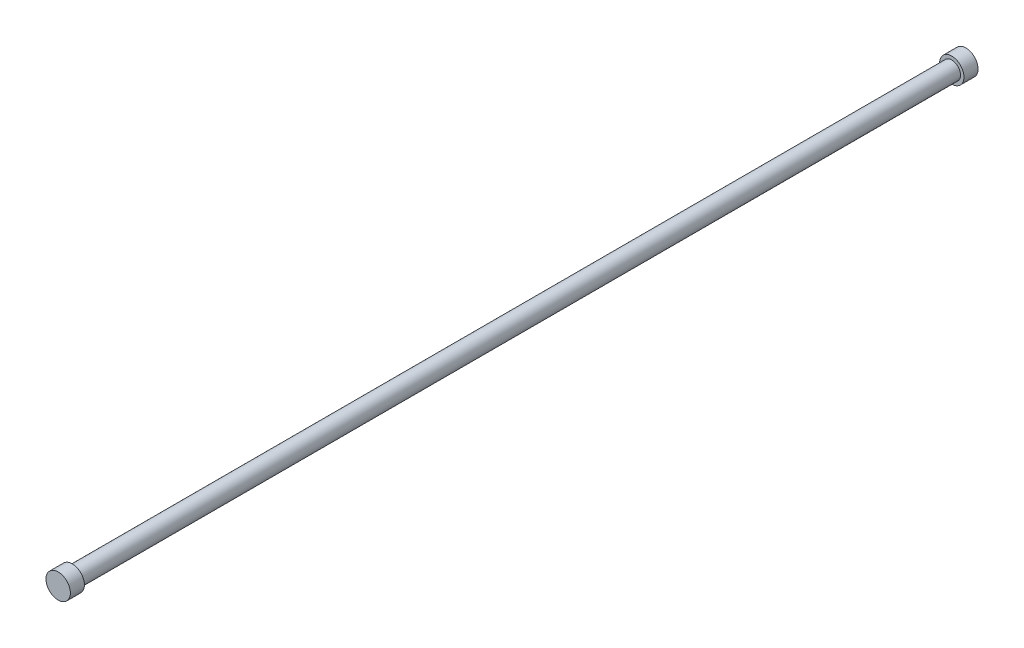
from build123d import *

# Parameters (mm, degrees)
SKETCH1_R           = 3.175
BOSS_EXTRUDE1_DEPTH = 317.5
SKETCH2_R           = 4.401668224
BOSS_EXTRUDE2_DEPTH = 5.08
BOSS_EXTRUDE3_START = 5.08
SKETCH3_R           = 4.401668224
BOSS_EXTRUDE3_DEPTH = 5.08


with BuildPart() as part:
    # Sketch1 → Boss-Extrude1 (new body)
    with BuildSketch(Plane.XY):
        with Locations(Location((0, 0, 0), (0, 0, 180))):
            Circle(SKETCH1_R)
    extrude(amount=BOSS_EXTRUDE1_DEPTH)

    # Sketch2 → Boss-Extrude2 (add)
    with BuildSketch(Plane(origin=(0, 0, 0), x_dir=(-1, 0, 0), z_dir=(0, 0, -1))):
        Circle(SKETCH2_R)
    extrude(amount=BOSS_EXTRUDE2_DEPTH)

    # Sketch3 → Boss-Extrude3 (add)
    with BuildSketch(Plane.XY.offset(317.5).offset(BOSS_EXTRUDE3_START)):
        with Locations(Location((0, 0, 0), (0, 0, 180))):
            Circle(SKETCH3_R)
    extrude(amount=-BOSS_EXTRUDE3_DEPTH)


solid = part.part
